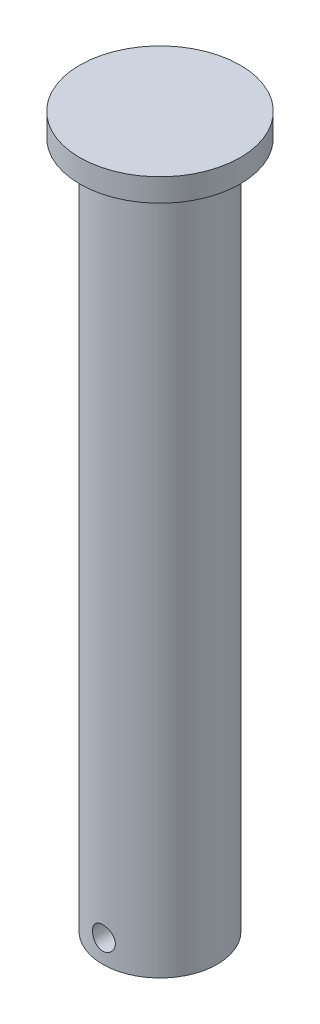
from build123d import *

# Parameters (mm, degrees)
CROQUIS2_R                             = 5
SALIENTE_EXTRUIR1_DEPTH                = 60
CROQUIS3_R                             = 7
SALIENTE_EXTRUIR2_DEPTH                = 2
CORTAR_EXTRUIR1_REACH                  = 64.785
CORTAR_EXTRUIR1_END_RADIUS             = 5
CROQUIS4_R                             = 1
CORTAR_EXTRUIR1_DIRECTION_2_REACH      = 64.785
CORTAR_EXTRUIR1_DIRECTION_2_END_RADIUS = 5


with BuildPart() as part:
    # Croquis2 → Saliente-Extruir1 (new body)
    with BuildSketch(Plane(origin=(0, 0, 0), x_dir=(1, 0, 0), z_dir=(0, 1, 0))):
        with Locations(Location((0, 0, 0), (0, 0, 270))):
            Circle(CROQUIS2_R)
    extrude(amount=SALIENTE_EXTRUIR1_DEPTH)

    # Croquis3 → Saliente-Extruir2 (add)
    with BuildSketch(Plane(origin=(0, 60, 0), x_dir=(1, 0, 0), z_dir=(0, 1, 0))):
        with Locations(Location((0, 0, 0), (0, 0, 270))):
            Circle(CROQUIS3_R)
    extrude(amount=SALIENTE_EXTRUIR2_DEPTH)

    # Cortar-Extruir1: up to this cylinder (the profile starts inside it)
    cortar_extruir1_end = Plane(origin=(0, 2, 0), z_dir=(0, -1, 0)) * Cylinder(CORTAR_EXTRUIR1_END_RADIUS, 140.57, mode=Mode.PRIVATE)
    # Croquis4 → Cortar-Extruir1 (cut, up to the surface)
    with BuildSketch(Plane.XY, mode=Mode.PRIVATE) as cortar_extruir1_sk1:
        with Locations((0, 2)):
            Circle(CROQUIS4_R)
    cortar_extruir1_tool1 = extrude(cortar_extruir1_sk1.sketch, amount=-CORTAR_EXTRUIR1_REACH, mode=Mode.PRIVATE) & cortar_extruir1_end
    add(cortar_extruir1_tool1.solids().sort_by_distance((0, 2, 0))[0], mode=Mode.SUBTRACT)

    # Cortar-Extruir1 direction 2: up to this cylinder (the profile starts inside it)
    cortar_extruir1_direction_2_end = Plane(origin=(0, 2, 0), z_dir=(0, -1, 0)) * Cylinder(CORTAR_EXTRUIR1_DIRECTION_2_END_RADIUS, 140.57, mode=Mode.PRIVATE)
    # Croquis4 → Cortar-Extruir1 direction 2 (cut, up to the surface)
    with BuildSketch(Plane.XY, mode=Mode.PRIVATE) as cortar_extruir1_direction_2_sk1:
        with Locations((0, 2)):
            Circle(CROQUIS4_R)
    cortar_extruir1_direction_2_tool1 = extrude(cortar_extruir1_direction_2_sk1.sketch, amount=CORTAR_EXTRUIR1_DIRECTION_2_REACH, mode=Mode.PRIVATE) & cortar_extruir1_direction_2_end
    add(cortar_extruir1_direction_2_tool1.solids().sort_by_distance((0, 2, 0))[0], mode=Mode.SUBTRACT)


solid = part.part
